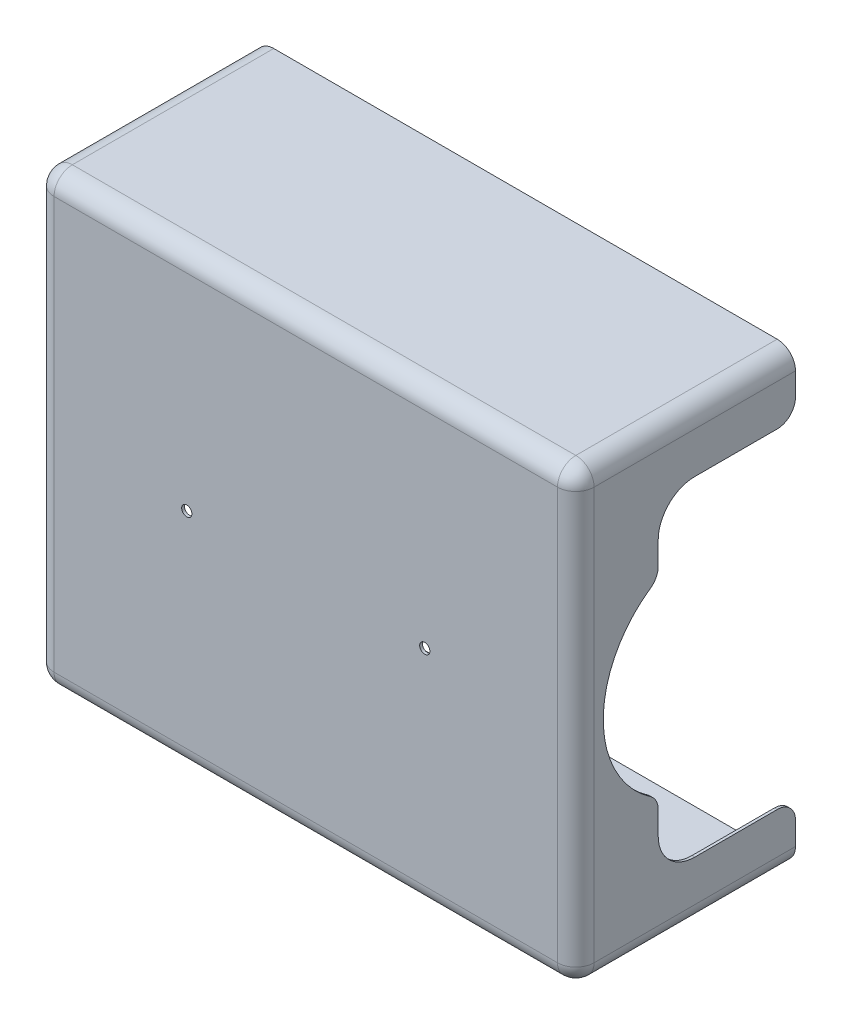
from build123d import *

# Parameters (mm, degrees)
SKETCH_1_W          = 295
SKETCH_1_H          = 245
EXTRUDE_1_DEPTH     = 120
FILLET_1_R          = 10
SHELL_1_T           = -1.5
CUT_EXTRUDE_1_DEPTH = 342.220236797
SKETCH_3_W          = 150
SKETCH_3_H          = 60
CUT_EXTRUDE_2_DEPTH = 342.220236797
FILLET_2_R          = 10
FILLET_3_R          = 20
SKETCH_4_R          = 2.8
CUT_EXTRUDE_3_DEPTH = 10


with BuildPart() as part:
    # 草图1 → 凸台-拉伸1 (new body)
    with BuildSketch(Plane.XY):
        Rectangle(SKETCH_1_W, SKETCH_1_H)
    extrude(amount=EXTRUDE_1_DEPTH)

    # 圆角1
    fillet_1_edges = [part.edges().sort_by_distance(p)[0] for p in [
        (-147.5, 0, 120),
        (0, -122.5, 120),
        (147.5, 0, 120),
        (147.5, -122.5, 60),
        (-147.5, -122.5, 60),
        (-147.5, 122.5, 60),
        (147.5, 122.5, 60),
        (0, 122.5, 120),
    ]]
    fillet(fillet_1_edges, radius=FILLET_1_R)

    # 抽壳1
    shell_1_openings = [part.faces().sort_by_distance(p)[0] for p in [
        (0, 0, 0),
    ]]
    offset(amount=SHELL_1_T, openings=shell_1_openings, kind=Kind.INTERSECTION)

    # 草图2 → 切除-拉伸1 (cut, through all)
    with BuildSketch(Plane.ZY.offset(147.5)):
        with BuildLine():
            ThreePointArc((105, 0), (87.426406871, 42.426406871), (45, 60))
            Line((45, 60), (45, -60))
            ThreePointArc((45, -60), (87.426406871, -42.426406871), (105, 0))
        make_face()
        with BuildLine():
            Line((45, -60), (45, 60))
            ThreePointArc((45, 60), (20.313730334, 54.686269666), (0, 39.686269666))
            Line((0, 39.686269666), (0, -39.686269666))
            ThreePointArc((0, -39.686269666), (20.313730334, -54.686269666), (45, -60))
        make_face()
        with BuildLine():
            Line((0, -39.686269666), (0, 39.686269666))
            ThreePointArc((0, 39.686269666), (-15, 0), (0, -39.686269666))
        make_face()
        with BuildLine():
            Line((45, 60), (0, 60))
            Line((0, 60), (0, 39.686269666))
            ThreePointArc((0, 39.686269666), (20.313730334, 54.686269666), (45, 60))
        make_face()
        with BuildLine():
            Line((0, -39.686269666), (0, -60))
            Line((0, -60), (45, -60))
            ThreePointArc((45, -60), (20.313730334, -54.686269666), (0, -39.686269666))
        make_face()
    extrude(amount=-CUT_EXTRUDE_1_DEPTH, mode=Mode.SUBTRACT)

    # 草图3 → 切除-拉伸2 (cut, through all)
    with BuildSketch(Plane.ZY.offset(147.5)):
        with Locations((0, -60)):
            Rectangle(SKETCH_3_W, SKETCH_3_H)
        with Locations((0, 60)):
            Rectangle(SKETCH_3_W, SKETCH_3_H)
    extrude(amount=-CUT_EXTRUDE_2_DEPTH, mode=Mode.SUBTRACT)

    # 圆角2
    fillet_2_edges = [part.edges().sort_by_distance(p)[0] for p in [
        (146.75, 51.961524227, 75),
        (146.75, -51.961524227, 75),
        (146.75, -90, 0),
        (-146.75, -90, 0),
        (-146.75, -51.961524227, 75),
        (146.75, 90, 0),
        (-146.75, 90, 0),
        (-146.75, 51.961524227, 75),
    ]]
    fillet(fillet_2_edges, radius=FILLET_2_R)

    # 圆角3
    fillet_3_edges = [part.edges().sort_by_distance(p)[0] for p in [
        (146.75, -90, 75),
        (-146.75, -90, 75),
        (-146.75, 90, 75),
        (146.75, 90, 75),
    ]]
    fillet(fillet_3_edges, radius=FILLET_3_R)

    # 草图4 → 切除-拉伸3 (cut)
    with BuildSketch(Plane.XY.offset(120)):
        with Locations((-65, 0)):
            Circle(SKETCH_4_R)
        with Locations((65, 0)):
            Circle(SKETCH_4_R)
    extrude(amount=-CUT_EXTRUDE_3_DEPTH, mode=Mode.SUBTRACT)


solid = part.part
